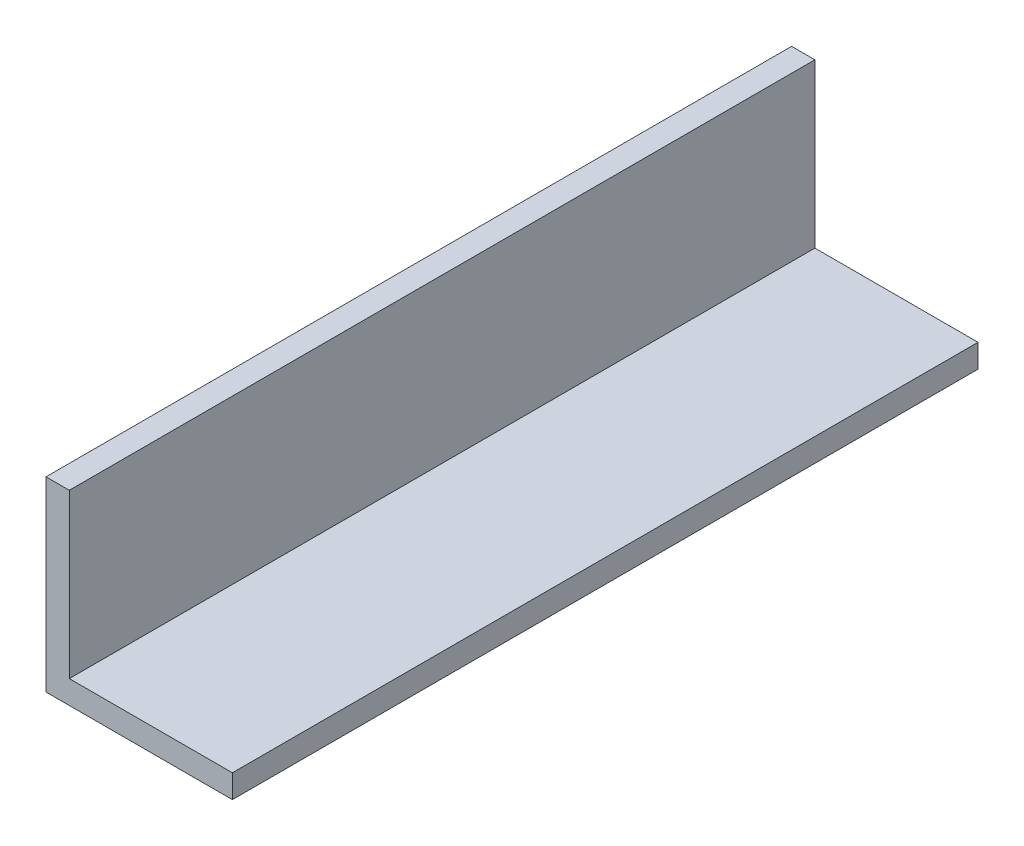
from build123d import *

# Parameters (mm, degrees)
BOSS_EXTRUDE1_DEPTH = 101.6


with BuildPart() as part:
    # Sketch1 → Boss-Extrude1 (new body)
    with BuildSketch(Plane.XY):
        Polygon((0, 0), (0, 25.4), (3.175, 25.4), (3.175, 3.175), (25.4, 3.175), (25.4, 0), align=None)
    extrude(amount=BOSS_EXTRUDE1_DEPTH)


solid = part.part
